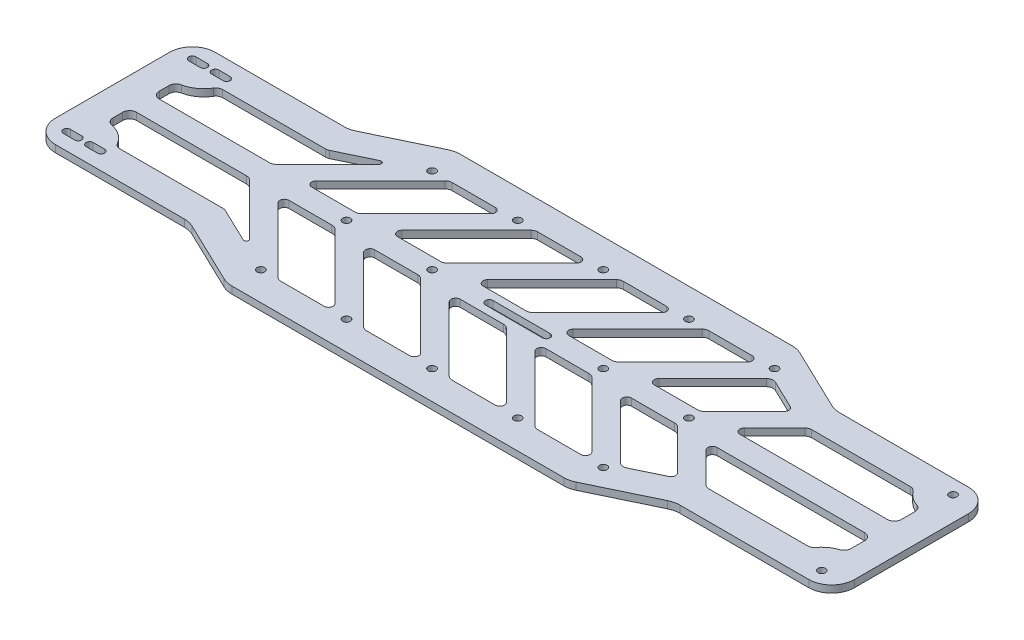
from build123d import *

# Parameters (mm, degrees)
SKETCH1_W            = 355.6
SKETCH1_H            = 101.6
BOSS_EXTRUDE1_DEPTH  = 3.175
M3_CLEARANCE_HOLE2_D = 3.4
CUT_EXTRUDE1_DEPTH   = 370.843210868
CUT_EXTRUDE3_DEPTH   = 370.843210868
FILLET1_R            = 10.16
M3_CLEARANCE_HOLE5_D = 3.4
CUT_EXTRUDE4_DEPTH   = 370.843210868
FILLET2_R            = 2.032
FILLET3_R            = 3.048
FILLET4_R            = 3.048
FILLET5_R            = 3.048
FILLET6_R            = 3.048
FILLET7_R            = 2.032
FILLET8_R            = 1.016
CUT_EXTRUDE5_DEPTH   = 370.843210868
LPATTERN1_COUNT      = 2
LPATTERN1_PITCH      = 10.16


with BuildPart() as part:
    # Sketch1 → Boss-Extrude1 (new body)
    with BuildSketch(Plane(origin=(0, 0, 0), x_dir=(1, 0, 0), z_dir=(0, 1, 0))):
        with Locations((177.8, 50.8)):
            Rectangle(SKETCH1_W, SKETCH1_H)
    extrude(amount=BOSS_EXTRUDE1_DEPTH)

    # M3 Clearance Hole2 (through all)
    with Locations(Plane(origin=(0, 0, 0), x_dir=(-1, 0, 0), z_dir=(0, -1, 0))):
        with Locations((-344.86342, 21.59), (-344.86342, 80.01)):
            Hole(M3_CLEARANCE_HOLE2_D / 2)

    # Sketch7 → Cut-Extrude1 (cut, through all)
    with BuildSketch(Plane.XZ):
        with BuildLine():
            Line((7.62, -21.283803), (12.7, -21.283803))
            ThreePointArc((12.7, -21.283803), (14.276197, -22.86), (12.7, -24.436197))
            Line((12.7, -24.436197), (7.62, -24.436197))
            ThreePointArc((7.62, -24.436197), (6.043803, -22.86), (7.62, -21.283803))
        make_face()
        with BuildLine():
            Line((7.62, -80.316197), (12.7, -80.316197))
            ThreePointArc((12.7, -80.316197), (14.276197, -78.74), (12.7, -77.163803))
            Line((12.7, -77.163803), (7.62, -77.163803))
            ThreePointArc((7.62, -77.163803), (6.043803, -78.74), (7.62, -80.316197))
        make_face()
    cut_extrude1 = extrude(amount=-CUT_EXTRUDE1_DEPTH, mode=Mode.SUBTRACT)

    # Sketch16 → Cut-Extrude3 (cut, through all)
    with BuildSketch(Plane(origin=(0, 3.175, 0), x_dir=(1, 0, 0), z_dir=(0, 1, 0))):
        Polygon((355.6, 15.24), (285.75, 15.24), (254, 0), (355.6, 0), align=None)
        Polygon((69.85, 15.24), (101.6, 0), (0, 0), (0, 15.24), align=None)
        Polygon((0, 86.36), (69.85, 86.36), (101.6, 101.6), (0, 101.6), align=None)
        Polygon((285.75, 86.36), (254, 101.6), (355.6, 101.6), (355.6, 86.36), align=None)
    extrude(amount=-CUT_EXTRUDE3_DEPTH, mode=Mode.SUBTRACT)

    # Fillet1
    fillet1_edges = [part.edges().sort_by_distance(p)[0] for p in [
        (355.6, 1.5875, -15.24),
        (254, 1.5875, 0),
        (285.75, 1.5875, -15.24),
        (0, 1.5875, -15.24),
        (69.85, 1.5875, -15.24),
        (101.6, 1.5875, 0),
        (0, 1.5875, -86.36),
        (101.6, 1.5875, -101.6),
        (69.85, 1.5875, -86.36),
        (355.6, 1.5875, -86.36),
        (285.75, 1.5875, -86.36),
        (254, 1.5875, -101.6),
    ]]
    fillet(fillet1_edges, radius=FILLET1_R)

    # M3 Clearance Hole5 (through all)
    with Locations(Plane(origin=(0, 3.175, 0), x_dir=(1, 0, 0), z_dir=(0, 1, 0))):
        with Locations((104.14, 88.9), (142.24, 88.9), (180.34, 88.9), (218.44, 88.9), (256.54, 88.9), (256.54, 12.7), (218.44, 12.7), (180.34, 12.7), (142.24, 12.7), (104.14, 12.7), (104.14, 50.8), (256.54, 50.8), (142.24, 50.8), (180.34, 50.8), (218.44, 50.8)):
            Hole(M3_CLEARANCE_HOLE5_D / 2)

    # Sketch17 → Cut-Extrude4 (cut, through all)
    with BuildSketch(Plane(origin=(0, 3.175, 0), x_dir=(1, 0, 0), z_dir=(0, 1, 0))):
        Polygon((111.76, 88.9), (78.74, 55.88), (104.14, 55.88), (137.16, 88.9), align=None)
        Polygon((78.74, 45.72), (104.14, 45.72), (137.16, 12.7), (111.76, 12.7), align=None)
        Polygon((175.26, 88.9), (149.86, 88.9), (116.84, 55.88), (142.24, 55.88), align=None)
        Polygon((116.84, 45.72), (142.24, 45.72), (175.26, 12.7), (149.86, 12.7), align=None)
        Polygon((213.36, 88.9), (187.96, 88.9), (154.94, 55.88), (180.34, 55.88), align=None)
        Polygon((154.94, 45.72), (180.34, 45.72), (213.36, 12.7), (187.96, 12.7), align=None)
        Polygon((251.46, 88.9), (226.06, 88.9), (193.04, 55.88), (218.44, 55.88), align=None)
        Polygon((193.04, 45.72), (218.44, 45.72), (251.46, 12.7), (226.06, 12.7), align=None)
        Polygon((260.041081081, 84.781081081), (231.14, 55.88), (256.54, 55.88), (277.203243243, 76.543243243), align=None)
        Polygon((231.14, 45.72), (256.54, 45.72), (277.203243243, 25.056756757), (260.041081081, 16.818918919), align=None)
        with BuildLine():
            Line((287.02, 73.66), (269.24, 55.88))
            Line((269.24, 55.88), (342.9, 55.88))
            Line((342.9, 55.88), (342.9, 67.462690252))
            ThreePointArc((342.9, 67.462690252), (337.679782259, 69.536922668), (333.864897372, 73.66))
            Line((333.864897372, 73.66), (287.02, 73.66))
        make_face()
        with BuildLine():
            Line((269.24, 45.72), (342.9, 45.72))
            Line((342.9, 45.72), (342.9, 34.137309748))
            ThreePointArc((342.9, 34.137309748), (337.679782259, 32.063077332), (333.864897372, 27.94))
            Line((333.864897372, 27.94), (287.02, 27.94))
            Line((287.02, 27.94), (269.24, 45.72))
        make_face()
        with BuildLine():
            Line((12.7, 55.88), (66.04, 55.88))
            Line((66.04, 55.88), (86.36, 76.2))
            Line((86.36, 76.2), (94.047554966, 83.887554966))
            Line((94.047554966, 83.887554966), (72.740148787, 73.66))
            Line((72.740148787, 73.66), (24.339742265, 73.66))
            ThreePointArc((24.339742265, 73.66), (19.65607648, 68.114417663), (12.7, 66.04))
            Line((12.7, 66.04), (12.7, 55.88))
        make_face()
        with BuildLine():
            Line((12.7, 45.72), (66.04, 45.72))
            Line((66.04, 45.72), (86.36, 25.4))
            Line((86.36, 25.4), (94.047554966, 17.712445034))
            Line((94.047554966, 17.712445034), (72.740148787, 27.94))
            Line((72.740148787, 27.94), (24.339742265, 27.94))
            ThreePointArc((24.339742265, 27.94), (19.65607648, 33.485582337), (12.7, 35.56))
            Line((12.7, 35.56), (12.7, 45.72))
        make_face()
    extrude(amount=-CUT_EXTRUDE4_DEPTH, mode=Mode.SUBTRACT)

    # Fillet2
    fillet2_edges = [part.edges().sort_by_distance(p)[0] for p in [
        (137.16, 1.5875, -88.9),
        (78.74, 1.5875, -55.88),
        (78.74, 1.5875, -45.72),
        (137.16, 1.5875, -12.7),
        (116.84, 1.5875, -55.88),
        (175.26, 1.5875, -88.9),
        (116.84, 1.5875, -45.72),
        (175.26, 1.5875, -12.7),
        (154.94, 1.5875, -55.88),
        (213.36, 1.5875, -88.9),
        (154.94, 1.5875, -45.72),
        (213.36, 1.5875, -12.7),
        (193.04, 1.5875, -55.88),
        (251.46, 1.5875, -88.9),
        (193.04, 1.5875, -45.72),
        (251.46, 1.5875, -12.7),
    ]]
    fillet(fillet2_edges, radius=FILLET2_R)

    # Fillet3
    fillet3_edges = [part.edges().sort_by_distance(p)[0] for p in [
        (111.76, 1.5875, -88.9),
        (104.14, 1.5875, -55.88),
        (111.76, 1.5875, -12.7),
        (104.14, 1.5875, -45.72),
        (149.86, 1.5875, -88.9),
        (142.24, 1.5875, -55.88),
        (149.86, 1.5875, -12.7),
        (142.24, 1.5875, -45.72),
        (187.96, 1.5875, -88.9),
        (180.34, 1.5875, -55.88),
        (187.96, 1.5875, -12.7),
        (180.34, 1.5875, -45.72),
        (226.06, 1.5875, -88.9),
        (218.44, 1.5875, -55.88),
        (226.06, 1.5875, -12.7),
        (218.44, 1.5875, -45.72),
    ]]
    fillet(fillet3_edges, radius=FILLET3_R)

    # Fillet4
    fillet4_edges = [part.edges().sort_by_distance(p)[0] for p in [
        (12.7, 1.5875, -55.88),
        (12.7, 1.5875, -66.04),
        (24.339742265, 1.5875, -73.66),
        (72.740148787, 1.5875, -73.66),
        (66.04, 1.5875, -55.88),
    ]]
    fillet(fillet4_edges, radius=FILLET4_R)

    # Fillet5
    fillet5_edges = [part.edges().sort_by_distance(p)[0] for p in [
        (12.7, 1.5875, -35.56),
        (12.7, 1.5875, -45.72),
        (66.04, 1.5875, -45.72),
        (72.740148787, 1.5875, -27.94),
        (24.339742265, 1.5875, -27.94),
    ]]
    fillet(fillet5_edges, radius=FILLET5_R)

    # Fillet6
    fillet6_edges = [part.edges().sort_by_distance(p)[0] for p in [
        (260.041081081, 1.5875, -84.781081081),
        (256.54, 1.5875, -55.88),
        (260.041081081, 1.5875, -16.818918919),
        (256.54, 1.5875, -45.72),
        (287.02, 1.5875, -73.66),
        (333.864897372, 1.5875, -73.66),
        (342.9, 1.5875, -67.462690252),
        (342.9, 1.5875, -55.88),
        (287.02, 1.5875, -27.94),
        (342.9, 1.5875, -45.72),
        (342.9, 1.5875, -34.137309748),
        (333.864897372, 1.5875, -27.94),
    ]]
    fillet(fillet6_edges, radius=FILLET6_R)

    # Fillet7
    fillet7_edges = [part.edges().sort_by_distance(p)[0] for p in [
        (277.203243243, 1.5875, -76.543243243),
        (231.14, 1.5875, -55.88),
        (231.14, 1.5875, -45.72),
        (277.203243243, 1.5875, -25.056756757),
        (269.24, 1.5875, -55.88),
        (269.24, 1.5875, -45.72),
    ]]
    fillet(fillet7_edges, radius=FILLET7_R)

    # Fillet8
    fillet8_edges = [part.edges().sort_by_distance(p)[0] for p in [
        (94.047554966, 1.5875, -83.887554966),
        (94.047554966, 1.5875, -17.712445034),
    ]]
    fillet(fillet8_edges, radius=FILLET8_R)

    # Sketch20 → Cut-Extrude5 (cut, through all)
    with BuildSketch(Plane(origin=(0, 3.175, 0), x_dir=(1, 0, 0), z_dir=(0, 1, 0))):
        with BuildLine():
            Line((167.64, 52.5), (193.04, 52.5))
            ThreePointArc((193.04, 52.5), (194.74, 50.8), (193.04, 49.1))
            Line((193.04, 49.1), (167.64, 49.1))
            ThreePointArc((167.64, 49.1), (165.94, 50.8), (167.64, 52.5))
        make_face()
    extrude(amount=-CUT_EXTRUDE5_DEPTH, mode=Mode.SUBTRACT)

    # LPattern1: Cut-Extrude1 ×2
    with Locations(*[(i * LPATTERN1_PITCH, 0, 0) for i in range(1, LPATTERN1_COUNT)]):
        add(cut_extrude1, mode=Mode.SUBTRACT)


solid = part.part
